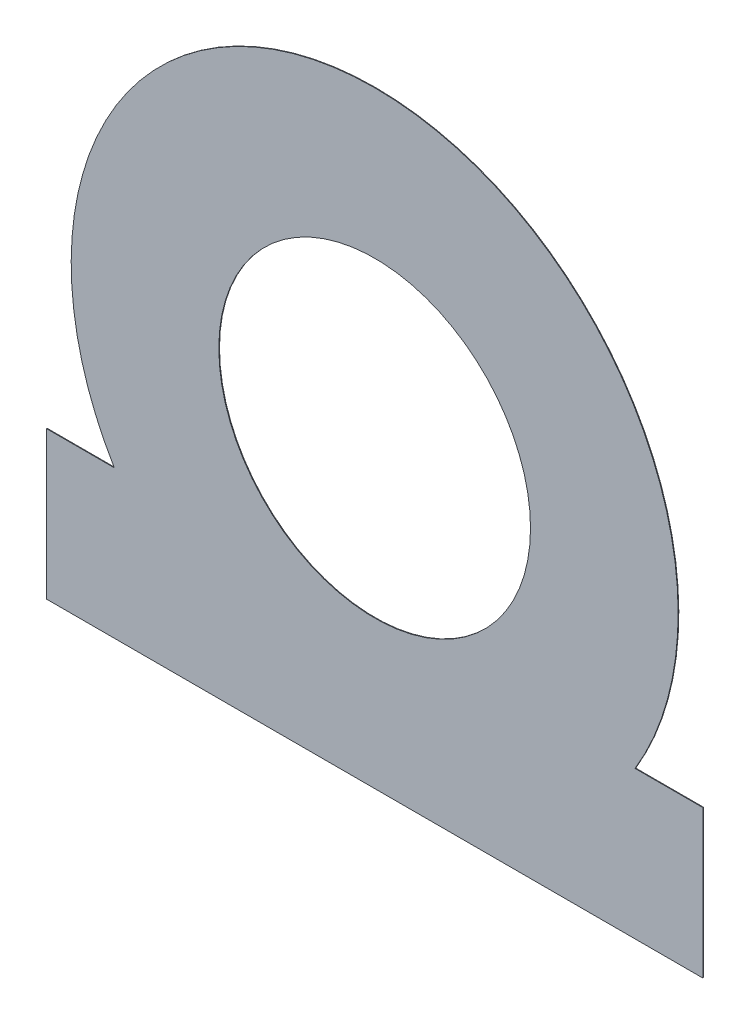
from build123d import *

# Parameters (mm, degrees)
SKETCH_1_R      = 475
EXTRUDE_1_DEPTH = 2


with BuildPart() as part:
    # 草图1 → 凸台-拉伸1 (new body)
    with BuildSketch(Plane.XY):
        with BuildLine():
            Line((1000, -925), (-1000, -925))
            Line((-1000, -925), (-1000, -475))
            Line((-1000, -475), (-793.725393319, -475))
            ThreePointArc((-793.725393319, -475), (0, 925), (793.725393319, -475))
            Line((793.725393319, -475), (1000, -475))
            Line((1000, -475), (1000, -925))
        make_face()
        Circle(SKETCH_1_R, mode=Mode.SUBTRACT)
    extrude(amount=EXTRUDE_1_DEPTH)


solid = part.part
